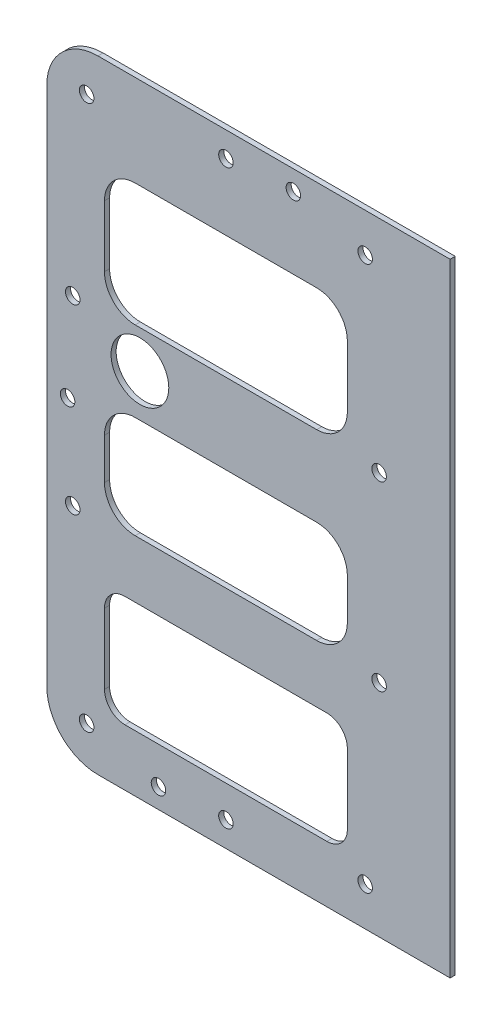
from build123d import *

# Parameters (mm, degrees)
SKETCH2_W            = 111.125
SKETCH2_H            = 193.04
BOSS_EXTRUDE1_DEPTH  = 1.5875
M4_CLEARANCE_HOLE1_D = 4.5
FILLET1_R            = 15.875
SKETCH6_R            = 2.4003
SKETCH6_R_2          = 6.477
SKETCH6_R_3          = 4.5
SKETCH6_R_4          = 10.762
CUT_EXTRUDE1_DEPTH   = 212.192646736
SKETCH7_W            = 13.97
SKETCH7_H            = 193.04
BOSS_EXTRUDE2_DEPTH  = 1.5875
SKETCH8_W            = 75.32443897
SKETCH8_H            = 38.1
SKETCH8_R            = 4.5
SKETCH8_R_2          = 10.762
SKETCH8_H_2          = 31.75
SKETCH8_H_3          = 34.487219484
SKETCH8_R_3          = 2.4003
SKETCH8_R_4          = 6.477
SKETCH8_R_5          = 8.9535
CUT_EXTRUDE2_DEPTH   = 1.5875
FILLET2_R            = 9.525
FILLET3_R            = 6.35
FILLET4_R            = 9.525


with BuildPart() as part:
    # Sketch2 → Boss-Extrude1 (new body)
    # profile 1 of 2: a face of its own
    with BuildSketch(Plane.XY.offset(-401.504104662)):
        with Locations((-6.650833159, 105.295051609)):
            Rectangle(SKETCH2_W, SKETCH2_H)
        with BuildLine():
            ThreePointArc((40.429624387, 185.872334563), (40.429624387, 193.650509156), (32.651449794, 193.650509156))
            Line((32.651449794, 193.650509156), (29.670992248, 190.670051609))
            Line((29.670992248, 190.670051609), (-1.150833159, 190.670051609))
            Line((-1.150833159, 190.670051609), (-1.150833159, 194.079751609))
            ThreePointArc((-1.150833159, 194.079751609), (-6.650833159, 199.579751609), (-12.150833159, 194.079751609))
            Line((-12.150833159, 194.079751609), (-12.150833159, 190.670051609))
            Line((-12.150833159, 190.670051609), (-42.972658566, 190.670051609))
            Line((-42.972658566, 190.670051609), (-45.953116112, 193.650509156))
            ThreePointArc((-45.953116112, 193.650509156), (-53.731290705, 193.650509156), (-53.731290705, 185.872334563))
            Line((-53.731290705, 185.872334563), (-50.750833159, 182.891877016))
            Line((-50.750833159, 182.891877016), (-50.750833159, 138.989051609))
            Line((-50.750833159, 138.989051609), (-54.160533159, 138.989051609))
            ThreePointArc((-54.160533159, 138.989051609), (-59.660533159, 133.489051609), (-54.160533159, 127.989051609))
            Line((-54.160533159, 127.989051609), (-50.750833159, 127.989051609))
            Line((-50.750833159, 127.989051609), (-50.750833159, 82.601051609))
            Line((-50.750833159, 82.601051609), (-54.160533159, 82.601051609))
            ThreePointArc((-54.160533159, 82.601051609), (-59.660533159, 77.101051609), (-54.160533159, 71.601051609))
            Line((-54.160533159, 71.601051609), (-50.750833159, 71.601051609))
            Line((-50.750833159, 71.601051609), (-50.750833159, 27.698226203))
            Line((-50.750833159, 27.698226203), (-53.731290705, 24.717768656))
            ThreePointArc((-53.731290705, 24.717768656), (-53.731290705, 16.939594063), (-45.953116112, 16.939594063))
            Line((-45.953116112, 16.939594063), (-42.972658566, 19.920051609))
            Line((-42.972658566, 19.920051609), (-12.150833159, 19.920051609))
            Line((-12.150833159, 19.920051609), (-12.150833159, 16.510351609))
            ThreePointArc((-12.150833159, 16.510351609), (-6.650833159, 11.010351609), (-1.150833159, 16.510351609))
            Line((-1.150833159, 16.510351609), (-1.150833159, 19.920051609))
            Line((-1.150833159, 19.920051609), (29.670992248, 19.920051609))
            Line((29.670992248, 19.920051609), (32.651449794, 16.939594063))
            ThreePointArc((32.651449794, 16.939594063), (40.429624387, 16.939594063), (40.429624387, 24.717768656))
            Line((40.429624387, 24.717768656), (37.449166841, 27.698226203))
            Line((37.449166841, 27.698226203), (37.449166841, 71.601051609))
            Line((37.449166841, 71.601051609), (40.858866841, 71.601051609))
            ThreePointArc((40.858866841, 71.601051609), (46.358866841, 77.101051609), (40.858866841, 82.601051609))
            Line((40.858866841, 82.601051609), (37.449166841, 82.601051609))
            Line((37.449166841, 82.601051609), (37.449166841, 127.989051609))
            Line((37.449166841, 127.989051609), (40.858866841, 127.989051609))
            ThreePointArc((40.858866841, 127.989051609), (46.358866841, 133.489051609), (40.858866841, 138.989051609))
            Line((40.858866841, 138.989051609), (37.449166841, 138.989051609))
            Line((37.449166841, 138.989051609), (37.449166841, 182.891877016))
            Line((37.449166841, 182.891877016), (40.429624387, 185.872334563))
        make_face(mode=Mode.SUBTRACT)
    # profile 2 of 2: a face of its own
    with BuildSketch(Plane.XY.offset(-401.504104662)):
        with BuildLine():
            Line((37.449166841, 182.891877016), (40.429624387, 185.872334563))
            ThreePointArc((40.429624387, 185.872334563), (40.429624387, 193.650509156), (32.651449794, 193.650509156))
            Line((32.651449794, 193.650509156), (29.670992248, 190.670051609))
            Line((29.670992248, 190.670051609), (-1.150833159, 190.670051609))
            Line((-1.150833159, 190.670051609), (-1.150833159, 194.079751609))
            ThreePointArc((-1.150833159, 194.079751609), (-6.650833159, 199.579751609), (-12.150833159, 194.079751609))
            Line((-12.150833159, 194.079751609), (-12.150833159, 190.670051609))
            Line((-12.150833159, 190.670051609), (-42.972658566, 190.670051609))
            Line((-42.972658566, 190.670051609), (-45.953116112, 193.650509156))
            ThreePointArc((-45.953116112, 193.650509156), (-53.731290705, 193.650509156), (-53.731290705, 185.872334563))
            Line((-53.731290705, 185.872334563), (-50.750833159, 182.891877016))
            Line((-50.750833159, 182.891877016), (-50.750833159, 138.989051609))
            Line((-50.750833159, 138.989051609), (-54.160533159, 138.989051609))
            ThreePointArc((-54.160533159, 138.989051609), (-59.660533159, 133.489051609), (-54.160533159, 127.989051609))
            Line((-54.160533159, 127.989051609), (-50.750833159, 127.989051609))
            Line((-50.750833159, 127.989051609), (-50.750833159, 82.601051609))
            Line((-50.750833159, 82.601051609), (-54.160533159, 82.601051609))
            ThreePointArc((-54.160533159, 82.601051609), (-59.660533159, 77.101051609), (-54.160533159, 71.601051609))
            Line((-54.160533159, 71.601051609), (-50.750833159, 71.601051609))
            Line((-50.750833159, 71.601051609), (-50.750833159, 27.698226203))
            Line((-50.750833159, 27.698226203), (-53.731290705, 24.717768656))
            ThreePointArc((-53.731290705, 24.717768656), (-53.731290705, 16.939594063), (-45.953116112, 16.939594063))
            Line((-45.953116112, 16.939594063), (-42.972658566, 19.920051609))
            Line((-42.972658566, 19.920051609), (-12.150833159, 19.920051609))
            Line((-12.150833159, 19.920051609), (-12.150833159, 16.510351609))
            ThreePointArc((-12.150833159, 16.510351609), (-6.650833159, 11.010351609), (-1.150833159, 16.510351609))
            Line((-1.150833159, 16.510351609), (-1.150833159, 19.920051609))
            Line((-1.150833159, 19.920051609), (29.670992248, 19.920051609))
            Line((29.670992248, 19.920051609), (32.651449794, 16.939594063))
            ThreePointArc((32.651449794, 16.939594063), (40.429624387, 16.939594063), (40.429624387, 24.717768656))
            Line((40.429624387, 24.717768656), (37.449166841, 27.698226203))
            Line((37.449166841, 27.698226203), (37.449166841, 71.601051609))
            Line((37.449166841, 71.601051609), (40.858866841, 71.601051609))
            ThreePointArc((40.858866841, 71.601051609), (46.358866841, 77.101051609), (40.858866841, 82.601051609))
            Line((40.858866841, 82.601051609), (37.449166841, 82.601051609))
            Line((37.449166841, 82.601051609), (37.449166841, 127.989051609))
            Line((37.449166841, 127.989051609), (40.858866841, 127.989051609))
            ThreePointArc((40.858866841, 127.989051609), (46.358866841, 133.489051609), (40.858866841, 138.989051609))
            Line((40.858866841, 138.989051609), (37.449166841, 138.989051609))
            Line((37.449166841, 138.989051609), (37.449166841, 182.891877016))
        make_face()
    extrude(amount=BOSS_EXTRUDE1_DEPTH)

    # M4 Clearance Hole1 (through all)
    with Locations(Plane.XY.offset(-399.916604662)):
        with Locations((36.540537091, 189.761421859), (-6.650833159, 194.079751609), (-49.842203409, 189.761421859), (-54.160533159, 133.489051609), (-54.160533159, 77.101051609), (-49.842203409, 20.82868136), (-6.650833159, 16.510351609), (36.540537091, 20.82868136), (40.858866841, 77.101051609), (40.858866841, 133.489051609), (14.260079544, 195.670051609), (-55.750833159, 105.295051609), (-27.561745863, 14.920051609)):
            Hole(M4_CLEARANCE_HOLE1_D / 2)

    # Fillet1
    fillet1_edges = [part.edges().sort_by_distance(p)[0] for p in [
        (-62.213333159, 201.815051609, -400.710354662),
        (-62.213333159, 8.775051609, -400.710354662),
    ]]
    fillet(fillet1_edges, radius=FILLET1_R)

    # Sketch6 → Cut-Extrude1 (cut, through all)
    with BuildSketch(Plane.XY.offset(-399.916604662)):
        with Locations((-34.590833159, 43.382551609)):
            Circle(SKETCH6_R)
        with Locations((21.289166841, 43.382551609)):
            Circle(SKETCH6_R)
        with Locations((3.509166841, 43.382551609)):
            Circle(SKETCH6_R_2)
        with Locations((-16.810833159, 43.382551609)):
            Circle(SKETCH6_R_2)
        with Locations((-33.320833159, 123.670051609)):
            Circle(SKETCH6_R_2)
        with Locations((-25.150833159, 94.607131964)):
            Circle(SKETCH6_R_3)
        with Locations((11.849166841, 94.607131964)):
            Circle(SKETCH6_R_3)
        with Locations((11.849166841, 154.407971255)):
            Circle(SKETCH6_R_3)
        with Locations((-25.150833159, 154.407971255)):
            Circle(SKETCH6_R_3)
        with Locations((-6.650833159, 154.407971255)):
            Circle(SKETCH6_R_4)
        with Locations((-6.650833159, 94.607131964)):
            Circle(SKETCH6_R_4)
    extrude(amount=-CUT_EXTRUDE1_DEPTH, mode=Mode.SUBTRACT)

    # Sketch7 → Boss-Extrude2 (add)
    with BuildSketch(Plane.XY.offset(-399.916604662)):
        with Locations((55.896666841, 105.295051609)):
            Rectangle(SKETCH7_W, SKETCH7_H)
    extrude(amount=-BOSS_EXTRUDE2_DEPTH)

    # Sketch8 → Cut-Extrude2 (cut)
    # profile 1 of 4: a face of its own
    with BuildSketch(Plane.XY.offset(-399.916604662)):
        with Locations((-6.650833159, 154.407971255)):
            Rectangle(SKETCH8_W, SKETCH8_H)
        with Locations((11.849166841, 154.407971255)):
            Circle(SKETCH8_R, mode=Mode.SUBTRACT)
        with Locations((-6.650833159, 154.407971255)):
            Circle(SKETCH8_R_2, mode=Mode.SUBTRACT)
        with Locations((-25.150833159, 154.407971255)):
            Circle(SKETCH8_R, mode=Mode.SUBTRACT)
    # profile 2 of 4: a face of its own
    with BuildSketch(Plane.XY.offset(-399.916604662)):
        with Locations((-6.650833159, 94.607131964)):
            Rectangle(SKETCH8_W, SKETCH8_H_2)
        with Locations((11.849166841, 94.607131964)):
            Circle(SKETCH8_R, mode=Mode.SUBTRACT)
        with Locations((-6.650833159, 94.607131964)):
            Circle(SKETCH8_R_2, mode=Mode.SUBTRACT)
        with Locations((-25.150833159, 94.607131964)):
            Circle(SKETCH8_R, mode=Mode.SUBTRACT)
    # profile 3 of 4: a face of its own
    with BuildSketch(Plane.XY.offset(-399.916604662)):
        with Locations((-6.650833159, 43.601441867)):
            Rectangle(SKETCH8_W, SKETCH8_H_3)
        with Locations((-34.590833159, 43.382551609)):
            Circle(SKETCH8_R_3, mode=Mode.SUBTRACT)
        with Locations((-16.810833159, 43.382551609)):
            Circle(SKETCH8_R_4, mode=Mode.SUBTRACT)
        with Locations((3.509166841, 43.382551609)):
            Circle(SKETCH8_R_4, mode=Mode.SUBTRACT)
        with Locations((21.289166841, 43.382551609)):
            Circle(SKETCH8_R_3, mode=Mode.SUBTRACT)
    # profile 4 of 4: a face of its own
    with BuildSketch(Plane.XY.offset(-399.916604662)):
        with Locations((-33.320833159, 123.670051609)):
            Circle(SKETCH8_R_5)
        with Locations((-33.320833159, 123.670051609)):
            Circle(SKETCH8_R_4, mode=Mode.SUBTRACT)
    extrude(amount=-CUT_EXTRUDE2_DEPTH, mode=Mode.SUBTRACT)

    # Fillet2
    fillet2_edges = [part.edges().sort_by_distance(p)[0] for p in [
        (-44.313052644, 135.357971255, -400.710354662),
        (-44.313052644, 173.457971255, -400.710354662),
        (31.011386326, 173.457971255, -400.710354662),
        (31.011386326, 135.357971255, -400.710354662),
    ]]
    fillet(fillet2_edges, radius=FILLET2_R)

    # Fillet3
    fillet3_edges = [part.edges().sort_by_distance(p)[0] for p in [
        (-44.313052644, 60.845051609, -400.710354662),
        (31.011386326, 60.845051609, -400.710354662),
        (31.011386326, 26.357832125, -400.710354662),
        (-44.313052644, 26.357832125, -400.710354662),
    ]]
    fillet(fillet3_edges, radius=FILLET3_R)

    # Fillet4
    fillet4_edges = [part.edges().sort_by_distance(p)[0] for p in [
        (31.011386326, 110.482131964, -400.710354662),
        (31.011386326, 78.732131964, -400.710354662),
        (-44.313052644, 78.732131964, -400.710354662),
        (-44.313052644, 110.482131964, -400.710354662),
    ]]
    fillet(fillet4_edges, radius=FILLET4_R)


solid = part.part
